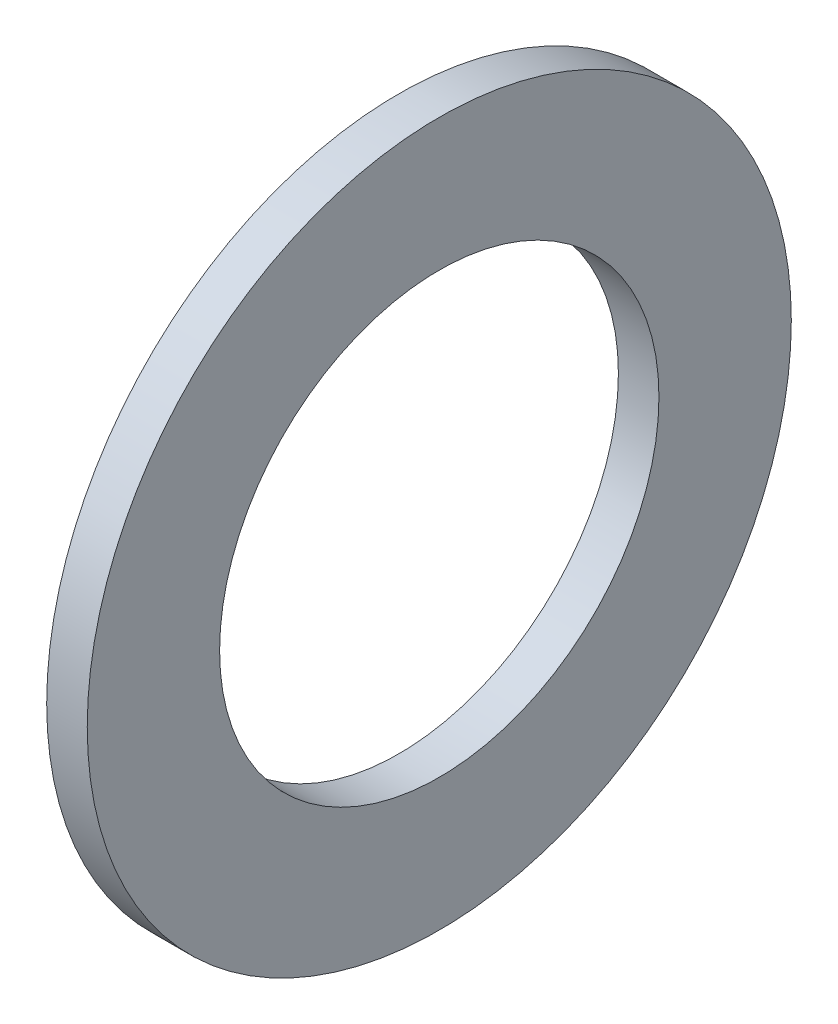
from build123d import *

# Parameters (mm, degrees)
SKETCH1_R           = 7.9375
SKETCH1_R_2         = 4.953
BOSS_EXTRUDE1_DEPTH = 0.9144


with BuildPart() as part:
    # Sketch1 → Boss-Extrude1 (new body)
    with BuildSketch(Plane(origin=(0, 0, 0), x_dir=(0, 0, -1), z_dir=(1, 0, 0))):
        Circle(SKETCH1_R)
        Circle(SKETCH1_R_2, mode=Mode.SUBTRACT)
    extrude(amount=BOSS_EXTRUDE1_DEPTH)


solid = part.part
